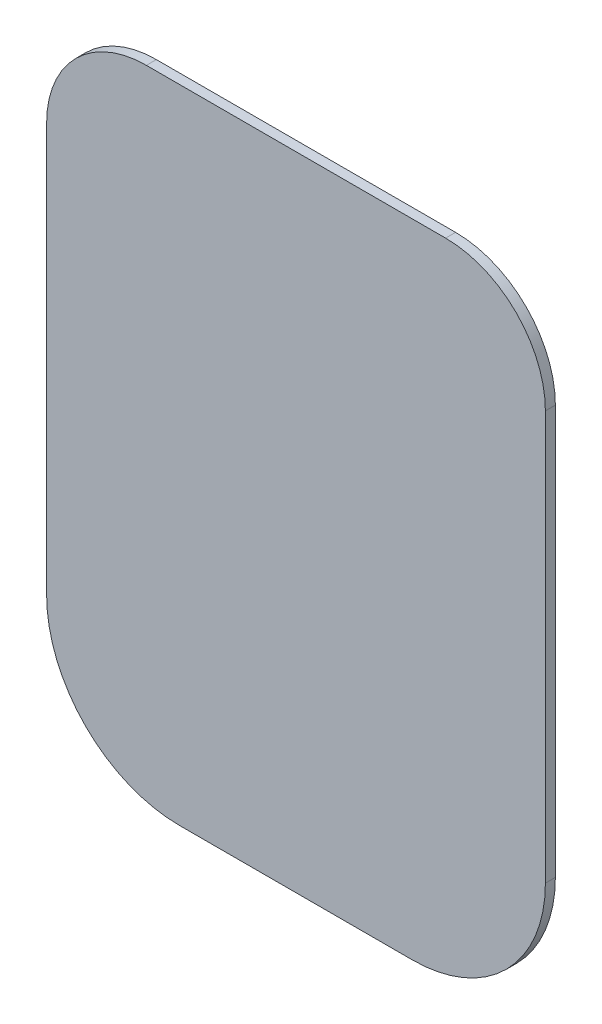
from build123d import *

# Parameters (mm, degrees)
BOSS_EXTRUDE1_DEPTH = 3


with BuildPart() as part:
    # Sketch1 → Boss-Extrude1 (new body)
    with BuildSketch(Plane.XY):
        with BuildLine():
            Line((-45, 96.5), (45, 96.5))
            ThreePointArc((45, 96.5), (66.213203436, 87.713203436), (75, 66.5))
            Line((75, 66.5), (75, -56.5))
            ThreePointArc((75, -56.5), (63.284271247, -84.784271247), (35, -96.5))
            Line((35, -96.5), (0.5, -96.5))
            Line((0.5, -96.5), (-0.5, -96.5))
            Line((-0.5, -96.5), (-35, -96.5))
            ThreePointArc((-35, -96.5), (-63.284271247, -84.784271247), (-75, -56.5))
            Line((-75, -56.5), (-75, 66.5))
            ThreePointArc((-75, 66.5), (-66.213203436, 87.713203436), (-45, 96.5))
        make_face()
    extrude(amount=BOSS_EXTRUDE1_DEPTH)


solid = part.part
